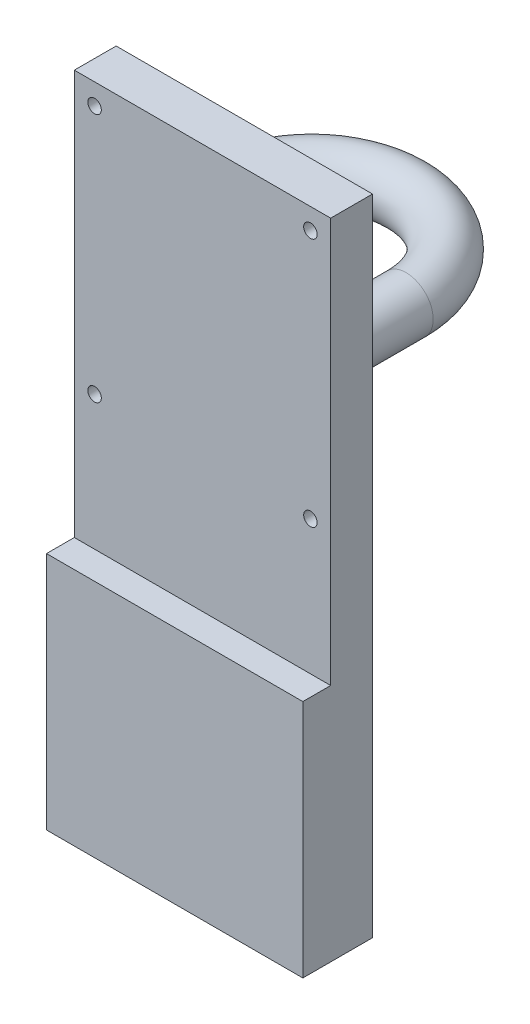
from build123d import *

# Parameters (mm, degrees)
ESQUISSE1_W             = 190
ESQUISSE1_H             = 300
BOSS_EXTRU_1_DEPTH      = 31
ESQUISSE2_R             = 5
ENL_V_MAT_EXTRU_1_DEPTH = 357.456168413
ESQUISSE3_W             = 190
ESQUISSE3_H             = 51.62
BOSS_EXTRU_2_DEPTH      = 177.45
ESQUISSE4_R             = 20
BOSS_EXTRU_3_DEPTH      = 50
ESQUISSE6_R             = 20
R_VOLUTION1_ANGLE       = 180


with BuildPart() as part:
    # Esquisse1 → Boss.-Extru.1 (new body)
    with BuildSketch(Plane.XY):
        with Locations((95, 150)):
            Rectangle(ESQUISSE1_W, ESQUISSE1_H)
    extrude(amount=BOSS_EXTRU_1_DEPTH)

    # Esquisse2 → Enlèv. mat.-Extru.1 (cut, through all)
    with BuildSketch(Plane(origin=(0, 0, 0), x_dir=(-1, 0, 0), z_dir=(0, 0, -1))):
        with Locations((-175, 284.5)):
            Circle(ESQUISSE2_R)
        with Locations((-15, 284.5)):
            Circle(ESQUISSE2_R)
        with Locations((-175, 99.5)):
            Circle(ESQUISSE2_R)
        with Locations((-15, 99.5)):
            Circle(ESQUISSE2_R)
    extrude(amount=-ENL_V_MAT_EXTRU_1_DEPTH, mode=Mode.SUBTRACT)

    # Esquisse3 → Boss.-Extru.2 (add)
    with BuildSketch(Plane.XZ):
        with Locations((95, 25.81)):
            Rectangle(ESQUISSE3_W, ESQUISSE3_H)
    extrude(amount=BOSS_EXTRU_2_DEPTH)

    # Esquisse4 → Boss.-Extru.3 (add)
    with BuildSketch(Plane(origin=(0, 0, 0), x_dir=(-1, 0, 0), z_dir=(0, 0, -1))):
        with Locations((-165, 192)):
            Circle(ESQUISSE4_R)
    boss_extru_3 = extrude(amount=BOSS_EXTRU_3_DEPTH)

    # Symétrie1: Boss.-Extru.3 across plane
    add(boss_extru_3.mirror(Plane(origin=(95, 0, 0), x_dir=(0, 0, 1), z_dir=(1, 0, 0))))

    # Esquisse6 → Révolution1 (revolve)
    with BuildSketch(Plane(origin=(0, 0, -50), x_dir=(-1, 0, 0), z_dir=(0, 0, -1))):
        with Locations(Location((-165, 192, 0), (0, 0, 180))):
            Circle(ESQUISSE6_R)
    revolve(axis=Axis((95, -201.3225, -50), (0, 1, 0)), revolution_arc=R_VOLUTION1_ANGLE)


solid = part.part
